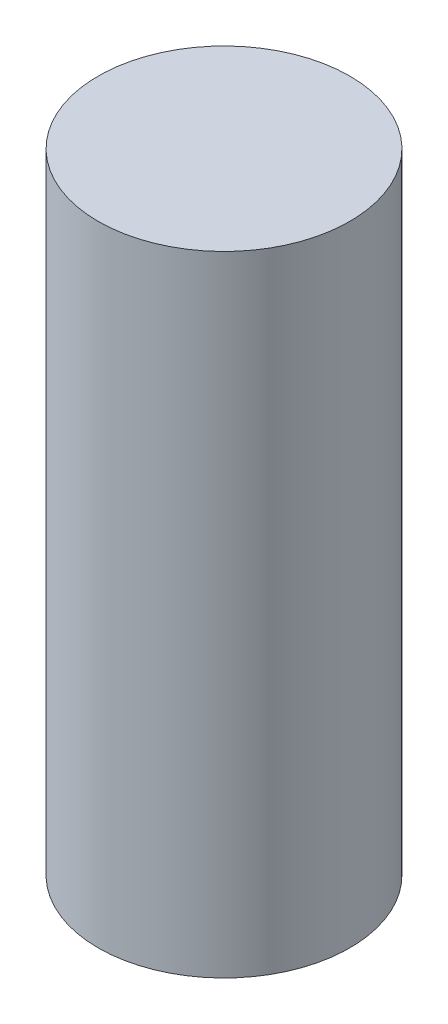
from build123d import *

# Parameters (mm, degrees)
RECONSTRUCTED_NOMINAL_AXIAL_PROFILE_W = 4
RECONSTRUCTED_NOMINAL_AXIAL_PROFILE_H = 20


with BuildPart() as part:
    # Reconstructed nominal axial profile → Native revolved geometry (revolve)
    with BuildSketch(Plane.XY, mode=Mode.PRIVATE) as native_revolved_geometry_sk:
        with Locations((2, 10)):
            Rectangle(RECONSTRUCTED_NOMINAL_AXIAL_PROFILE_W, RECONSTRUCTED_NOMINAL_AXIAL_PROFILE_H)
    revolve(native_revolved_geometry_sk.sketch.rotate(Axis((0, -500, 0), (0, 1, 0)), 90), axis=Axis((0, -500, 0), (0, 1, 0)))


solid = part.part
